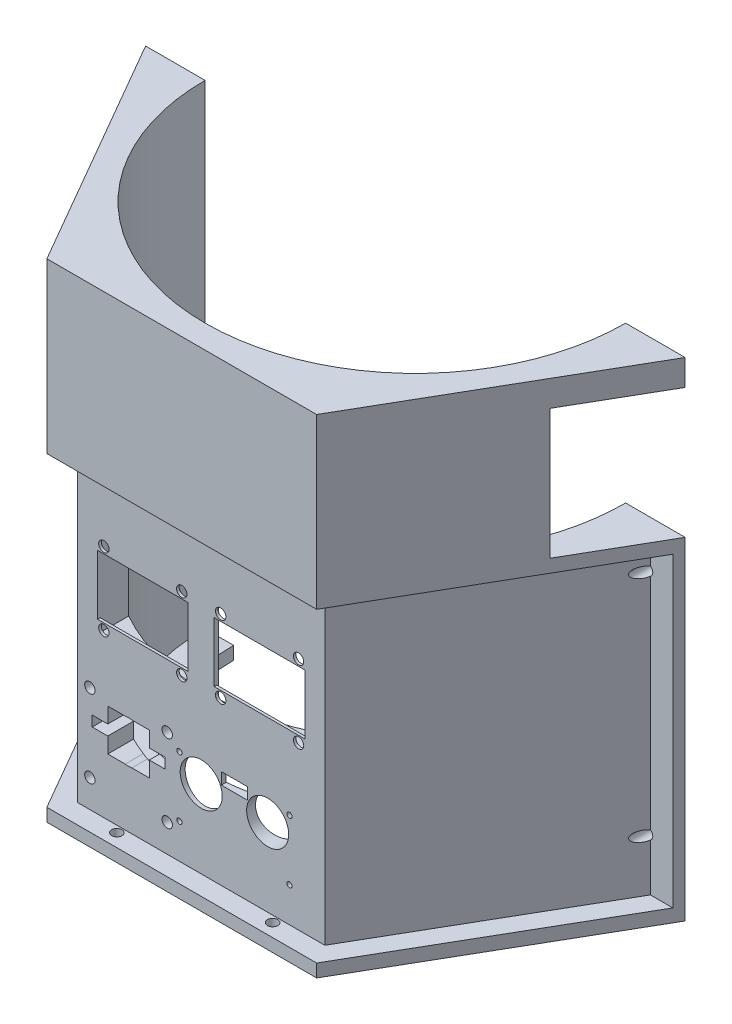
from build123d import *

# Parameters (mm, degrees)
BOSS_EXTRUDE2_DEPTH = 5
BOSS_EXTRUDE3_DEPTH = 118
BOSS_EXTRUDE4_DEPTH = 5
BOSS_EXTRUDE5_DEPTH = 50
BOSS_EXTRUDE6_DEPTH = 10
SKETCH7_W           = 35
SKETCH7_H           = 23
CUT_EXTRUDE1_DEPTH  = 1
CUT_EXTRUDE2_DEPTH  = 50
SKETCH9_R           = 8.1
CUT_EXTRUDE3_DEPTH  = 10
SKETCH10_R          = 2
CUT_EXTRUDE4_DEPTH  = 10
SKETCH11_R          = 2
CUT_EXTRUDE5_DEPTH  = 10
SKETCH12_R          = 2
CUT_EXTRUDE6_DEPTH  = 10
SKETCH13_R          = 1
CUT_EXTRUDE7_DEPTH  = 10
SKETCH14_R          = 2
SKETCH14_R_2        = 1
CUT_EXTRUDE10_DEPTH = 83
CUT_EXTRUDE11_DEPTH = 83


with BuildPart() as part:
    # Sketch1 → Boss-Extrude2 (new body)
    with BuildSketch(Plane(origin=(0, 0, 0), x_dir=(1, 0, 0), z_dir=(0, 1, 0))):
        with BuildLine():
            Line((-70, 0), (-103.923048454, 0))
            Line((-103.923048454, 0), (-51.961524227, -90))
            Line((-51.961524227, -90), (51.961524227, -90))
            Line((51.961524227, -90), (103.923048454, 0))
            Line((103.923048454, 0), (70, 0))
            ThreePointArc((70, 0), (0, -70), (-70, 0))
        make_face()
    extrude(amount=BOSS_EXTRUDE2_DEPTH)

    # Sketch3 → Boss-Extrude3 (add)
    with BuildSketch(Plane(origin=(0, 5, 0), x_dir=(1, 0, 0), z_dir=(0, 1, 0))):
        with BuildLine():
            Line((-103.923048454, 0), (-81, 0))
            ThreePointArc((-81, 0), (0, -81), (81, 0))
            Line((81, 0), (103.923048454, 0))
            Line((103.923048454, 0), (102.190997647, -3))
            Line((102.190997647, -3), (93.530743609, -3))
            Line((93.530743609, -3), (47.631397208, -82.5))
            Line((47.631397208, -82.5), (-47.631397208, -82.5))
            Line((-47.631397208, -82.5), (-93.530743609, -3))
            Line((-93.530743609, -3), (-102.190997647, -3))
            Line((-102.190997647, -3), (-103.923048454, 0))
        make_face()
    extrude(amount=BOSS_EXTRUDE3_DEPTH)

    # Sketch4 → Boss-Extrude4 (add)
    with BuildSketch(Plane(origin=(0, 123, 0), x_dir=(1, 0, 0), z_dir=(0, 1, 0))):
        with BuildLine():
            Line((-103.923048454, 0), (-81, 0))
            ThreePointArc((-81, 0), (0, -81), (81, 0))
            Line((81, 0), (103.923048454, 0))
            Line((103.923048454, 0), (51.961524227, -90))
            Line((51.961524227, -90), (-51.961524227, -90))
            Line((-51.961524227, -90), (-103.923048454, 0))
        make_face()
    extrude(amount=BOSS_EXTRUDE4_DEPTH)

    # Sketch5 → Boss-Extrude5 (add)
    with BuildSketch(Plane(origin=(0, 128, 0), x_dir=(1, 0, 0), z_dir=(0, 1, 0))):
        with BuildLine():
            Line((84.870489571, -33), (51.961524227, -90))
            Line((51.961524227, -90), (-51.961524227, -90))
            Line((-51.961524227, -90), (-103.923048454, 0))
            Line((-103.923048454, 0), (-81, 0))
            ThreePointArc((-81, 0), (-16.869937598, -79.22376667), (73.972968036, -33))
            Line((73.972968036, -33), (84.870489571, -33))
        make_face()
    extrude(amount=BOSS_EXTRUDE5_DEPTH)

    # Sketch6 → Boss-Extrude6 (add)
    with BuildSketch(Plane(origin=(0, 178, 0), x_dir=(1, 0, 0), z_dir=(0, 1, 0))):
        with BuildLine():
            Line((-103.923048454, 0), (-51.961524227, -90))
            Line((-51.961524227, -90), (51.961524227, -90))
            Line((51.961524227, -90), (103.923048454, 0))
            Line((103.923048454, 0), (81, 0))
            ThreePointArc((81, 0), (0, -81), (-81, 0))
            Line((-81, 0), (-103.923048454, 0))
        make_face()
    extrude(amount=BOSS_EXTRUDE6_DEPTH)

    # Sketch7 → Cut-Extrude1 (cut)
    with BuildSketch(Plane.XY.offset(82.5)):
        with Locations((-22.5, 81.5)):
            Rectangle(SKETCH7_W, SKETCH7_H)
        with Locations((22.5, 81.5)):
            Rectangle(SKETCH7_W, SKETCH7_H)
    extrude(amount=-CUT_EXTRUDE1_DEPTH, mode=Mode.SUBTRACT)

    # Sketch8 → Cut-Extrude2 (cut)
    with BuildSketch(Plane.XY.offset(81.5)):
        Polygon((-40, 93), (-40, 98), (-5, 98), (-5, 65), (-40, 65), (-40, 70), align=None)
        Polygon((5, 70), (5, 98), (40.042724373, 98), (40.042724373, 65), (5, 65), align=None)
    extrude(amount=-CUT_EXTRUDE2_DEPTH, mode=Mode.SUBTRACT)

    # Sketch9 → Cut-Extrude3 (cut)
    with BuildSketch(Plane.XY.offset(82.5)):
        with Locations((0, 35)):
            Circle(SKETCH9_R)
        with Locations((25.6, 35)):
            Circle(SKETCH9_R)
        with Locations((-28, 35)):
            Circle(SKETCH9_R)
    extrude(amount=-CUT_EXTRUDE3_DEPTH, mode=Mode.SUBTRACT)

    # Sketch10 → Cut-Extrude4 (cut)
    with BuildSketch(Plane(origin=(0, 0, 0), x_dir=(-1, 0, 0), z_dir=(0, 0, -1))):
        with Locations((92.461524227, 113)):
            Circle(SKETCH10_R)
        with Locations((-92.461524227, 113)):
            Circle(SKETCH10_R)
        with Locations((-92.461524227, 25)):
            Circle(SKETCH10_R)
        with Locations((92.461524227, 25)):
            Circle(SKETCH10_R)
    extrude(amount=-CUT_EXTRUDE4_DEPTH, mode=Mode.SUBTRACT)

    # Sketch11 → Cut-Extrude5 (cut)
    with BuildSketch(Plane.XZ):
        with Locations(Location((-30, 85, 0), (0, 0, 270))):
            Circle(SKETCH11_R)
        with Locations(Location((30, 85, 0), (0, 0, 270))):
            Circle(SKETCH11_R)
    extrude(amount=-CUT_EXTRUDE5_DEPTH, mode=Mode.SUBTRACT)

    # Sketch12 → Cut-Extrude6 (cut)
    with BuildSketch(Plane.XY.offset(82.5)):
        with Locations((-37.5, 95.5)):
            Circle(SKETCH12_R)
        with Locations((-7.5, 95.5)):
            Circle(SKETCH12_R)
        with Locations((-7.5, 67.5)):
            Circle(SKETCH12_R)
        with Locations((-37.5, 67.5)):
            Circle(SKETCH12_R)
        with Locations((7.5, 67.5)):
            Circle(SKETCH12_R)
        with Locations((37.5, 67.5)):
            Circle(SKETCH12_R)
        with Locations((7.5, 95.5)):
            Circle(SKETCH12_R)
        with Locations((37.5, 95.5)):
            Circle(SKETCH12_R)
    extrude(amount=-CUT_EXTRUDE6_DEPTH, mode=Mode.SUBTRACT)

    # Sketch13 → Cut-Extrude7 (cut)
    with BuildSketch(Plane.XY.offset(82.5)):
        with Locations((-8.4, 41.6)):
            Circle(SKETCH13_R)
        Polygon((7.75, 38.5), (12.8, 38.5), (17.85, 38.5), (17.85, 43), (12.8, 43), (7.75, 43), align=None)
        with Locations((-8.4, 18.4)):
            Circle(SKETCH13_R)
        with Locations((34, 18.4)):
            Circle(SKETCH13_R)
        with Locations((34, 41.6)):
            Circle(SKETCH13_R)
    extrude(amount=-CUT_EXTRUDE7_DEPTH, mode=Mode.SUBTRACT)

    # Sketch14 → Cut-Extrude10 (cut)
    with BuildSketch(Plane.XY.offset(82.5)):
        with Locations((-13.1, 45.7)):
            Circle(SKETCH14_R)
        with Locations((-8.4, 41.6)):
            Circle(SKETCH14_R_2)
        with Locations((-13.1, 15.7)):
            Circle(SKETCH14_R)
        with Locations((-42.9, 15.7)):
            Circle(SKETCH14_R)
        with Locations((-42.9, 45.7)):
            Circle(SKETCH14_R)
    extrude(amount=-CUT_EXTRUDE10_DEPTH, mode=Mode.SUBTRACT)

    # Sketch15 → Cut-Extrude11 (cut)
    with BuildSketch(Plane.XY.offset(82.5)):
        Polygon((-14, 35), (-14, 37), (-20, 37), (-20, 43), (-28, 43), (-36, 43), (-36, 37), (-42, 37), (-42, 35), (-42, 33), (-36, 33), (-36, 27), (-20, 27), (-20, 33), (-14, 33), align=None)
    extrude(amount=-CUT_EXTRUDE11_DEPTH, mode=Mode.SUBTRACT)


solid = part.part
